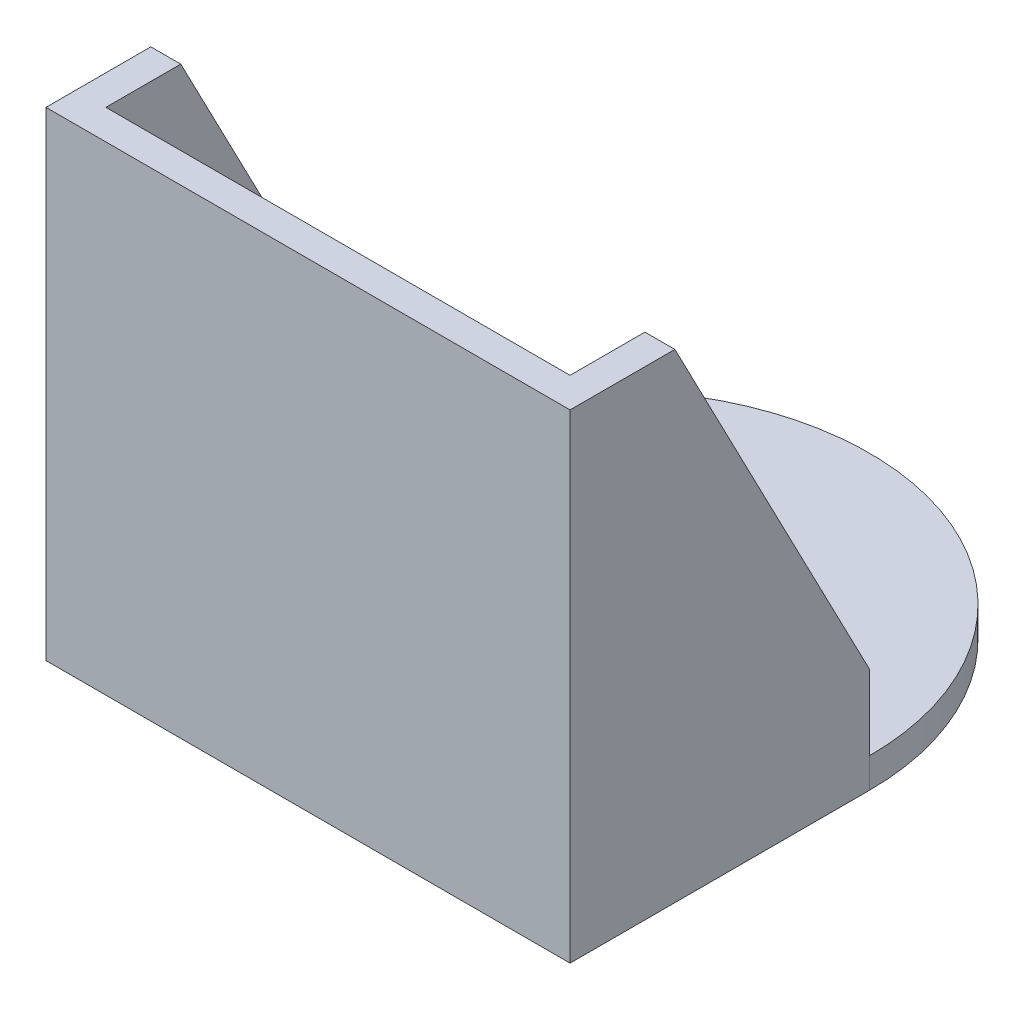
from build123d import *

# Parameters (mm, degrees)
SKETCH1_R           = 44.45
SKETCH1_R_2         = 19.05
SKETCH1_R_3         = 1.410622882
SKETCH1_R_4         = 1.22190068
SKETCH1_R_5         = 0.971343814
BOSS_EXTRUDE1_DEPTH = 5.08
BOSS_EXTRUDE2_DEPTH = 5.08
SKETCH3_W           = 88.9
SKETCH3_H           = 5.08
EXTRUDE_THIN1_DEPTH = 76.2
BOSS_EXTRUDE3_DEPTH = 5.08


with BuildPart() as part:
    # Sketch1 → Boss-Extrude1 (new body)
    with BuildSketch(Plane(origin=(0, 0, 0), x_dir=(1, 0, 0), z_dir=(0, 1, 0))):
        with Locations(Location((0, 0, 0), (0, 0, 270))):
            Circle(SKETCH1_R)
        with Locations(Location((0, 0, 0), (0, 0, 270))):
            Circle(SKETCH1_R_2, mode=Mode.SUBTRACT)
        with Locations(Location((0, 25.4, 0), (0, 0, 270))):
            Circle(SKETCH1_R_3, mode=Mode.SUBTRACT)
        with Locations(Location((21.997045256, -12.7, 0), (0, 0, 270))):
            Circle(SKETCH1_R_4, mode=Mode.SUBTRACT)
        with Locations(Location((-21.997045256, -12.7, 0), (0, 0, 270))):
            Circle(SKETCH1_R_5, mode=Mode.SUBTRACT)
    extrude(amount=BOSS_EXTRUDE1_DEPTH)

    # Sketch2 → Boss-Extrude2 (add)
    with BuildSketch(Plane(origin=(0, 0, 0), x_dir=(1, 0, 0), z_dir=(0, 1, 0))):
        with BuildLine():
            Line((-44.45, 0), (-44.45, -50.8))
            Line((-44.45, -50.8), (44.45, -50.8))
            Line((44.45, -50.8), (44.45, 0))
            ThreePointArc((44.45, 0), (0, -44.45), (-44.45, 0))
        make_face()
    extrude(amount=BOSS_EXTRUDE2_DEPTH)

    # Sketch3 → Extrude-Thin1 (add)
    with BuildSketch(Plane(origin=(0, 5.08, 0), x_dir=(1, 0, 0), z_dir=(0, 1, 0))):
        with Locations((0, -48.26)):
            Rectangle(SKETCH3_W, SKETCH3_H)
    extrude(amount=EXTRUDE_THIN1_DEPTH)

    # Sketch4 → Boss-Extrude3 (add)
    with BuildSketch(Plane.ZY.offset(44.45)):
        Polygon((0, 5.08), (0, 17.78), (33.02, 81.28), (45.72, 81.28), (45.72, 5.08), align=None)
    boss_extrude3 = extrude(amount=-BOSS_EXTRUDE3_DEPTH)

    # Mirror1: Boss-Extrude3 across plane
    add(boss_extrude3.mirror(Plane(origin=(0, 0, 0), x_dir=(0, 0, 1), z_dir=(1, 0, 0))))


solid = part.part
